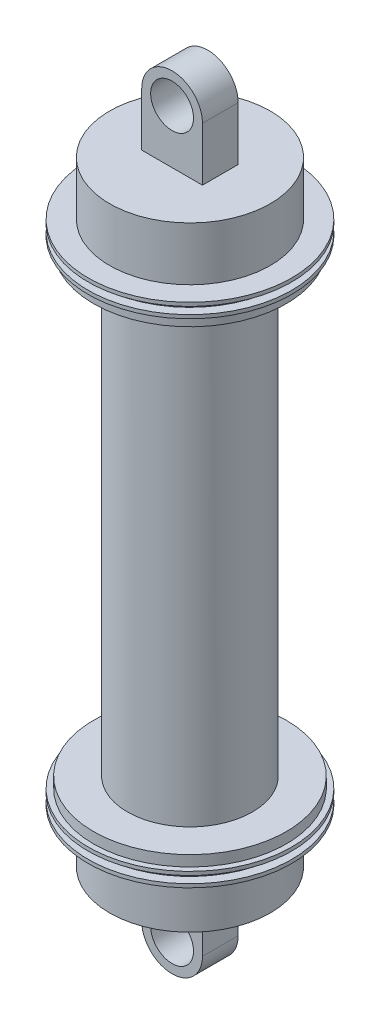
from build123d import *

# Parameters (mm, degrees)
SKETCH1_R           = 17.5
BOSS_EXTRUDE1_DEPTH = 142
SHELL1_T            = -2
SKETCH2_R           = 22.5
BOSS_EXTRUDE2_DEPTH = 15
SKETCH3_R           = 6
BOSS_EXTRUDE3_DEPTH = 5
SKETCH4_R           = 28.5
BOSS_EXTRUDE4_DEPTH = 1
SKETCH5_R           = 26
BOSS_EXTRUDE5_DEPTH = 2
SKETCH6_R           = 28.5
BOSS_EXTRUDE6_DEPTH = 1
SKETCH7_R           = 27
BOSS_EXTRUDE7_DEPTH = 3


with BuildPart() as part:
    # Sketch1 → Boss-Extrude1 (new body)
    with BuildSketch(Plane(origin=(0, 0, 0), x_dir=(1, 0, 0), z_dir=(0, 1, 0))):
        with Locations(Location((0, 0, 0), (0, 0, 270))):
            Circle(SKETCH1_R)
    extrude(amount=BOSS_EXTRUDE1_DEPTH)

    # Shell1
    shell1_openings = [part.faces().sort_by_distance(p)[0] for p in [
        (0, 142, 0),
        (0, 0, 0),
    ]]
    offset(amount=SHELL1_T, openings=shell1_openings, kind=Kind.INTERSECTION)

    # Sketch2 → Boss-Extrude2 (add)
    with BuildSketch(Plane.XZ):
        with Locations(Location((0, 0, 0), (0, 0, 270))):
            Circle(SKETCH2_R)
    boss_extrude2 = extrude(amount=BOSS_EXTRUDE2_DEPTH)

    # Sketch3 → Boss-Extrude3 (add, symmetric)
    with BuildSketch(Plane.XY):
        with BuildLine():
            Line((-8.5, -15), (-8.5, -30))
            ThreePointArc((-8.5, -30), (0, -38.5), (8.5, -30))
            Line((8.5, -30), (8.5, -15))
            Line((8.5, -15), (-8.5, -15))
        make_face()
        with Locations((0, -30)):
            Circle(SKETCH3_R, mode=Mode.SUBTRACT)
    boss_extrude3 = extrude(amount=BOSS_EXTRUDE3_DEPTH, both=True)

    # Mirror1: Boss-Extrude2, Boss-Extrude3 across plane
    add(boss_extrude2.mirror(Plane.ZX.offset(71)))
    add(boss_extrude3.mirror(Plane.ZX.offset(71)))

    # Sketch4 → Boss-Extrude4 (add)
    with BuildSketch(Plane.XZ.offset(-142)):
        with Locations(Location((0, 0, 0), (0, 0, 270))):
            Circle(SKETCH4_R)
    boss_extrude4 = extrude(amount=BOSS_EXTRUDE4_DEPTH)

    # Sketch5 → Boss-Extrude5 (add)
    with BuildSketch(Plane.XZ.offset(-141)):
        with Locations(Location((0, 0, 0), (0, 0, 270))):
            Circle(SKETCH5_R)
    boss_extrude5 = extrude(amount=BOSS_EXTRUDE5_DEPTH)

    # Sketch6 → Boss-Extrude6 (add)
    with BuildSketch(Plane.XZ.offset(-139)):
        with Locations(Location((0, 0, 0), (0, 0, 270))):
            Circle(SKETCH6_R)
    boss_extrude6 = extrude(amount=BOSS_EXTRUDE6_DEPTH)

    # Mirror2: Boss-Extrude4, Boss-Extrude5, Boss-Extrude6 across plane
    add(boss_extrude4.mirror(Plane.ZX.offset(71)))
    add(boss_extrude5.mirror(Plane.ZX.offset(71)))
    add(boss_extrude6.mirror(Plane.ZX.offset(71)))

    # Sketch7 → Boss-Extrude7 (add)
    with BuildSketch(Plane.XZ.offset(-138)):
        with Locations(Location((0, 0, 0), (0, 0, 270))):
            Circle(SKETCH7_R)
    boss_extrude7 = extrude(amount=BOSS_EXTRUDE7_DEPTH)

    # Mirror3: Boss-Extrude7 across plane
    add(boss_extrude7.mirror(Plane.ZX.offset(71)))


solid = part.part
